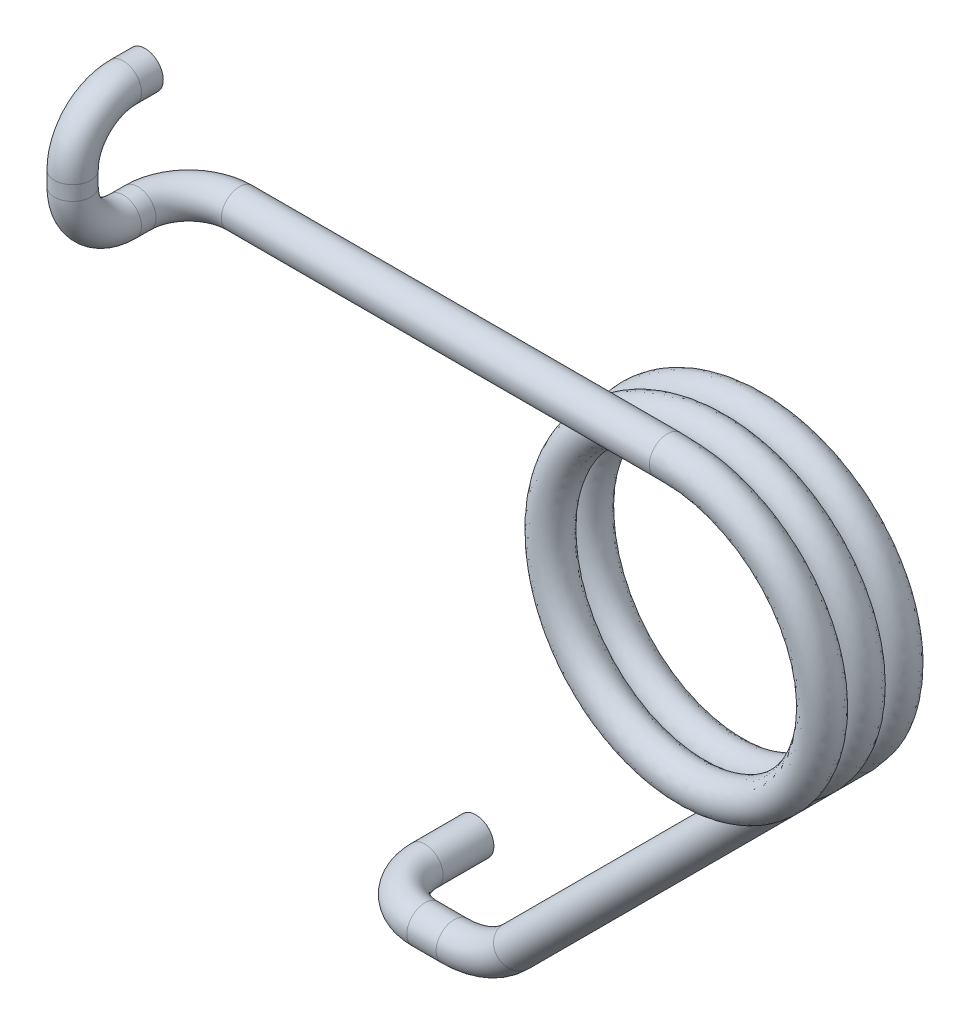
from build123d import *
from build123d.topology import SkipClean

# Parameters (mm, degrees)
BASE_BALAYAGE_PITCH       = 2.6
BASE_BALAYAGE_HEIGHT      = 6.175
BASE_BALAYAGE_RADIUS      = 10
BASE_BALAYAGE_START_ANGLE = 90
ESQUISSE2_R               = 1.25
ESQUISSE3_R               = 1.25
ESQUISSE4_R               = 1.25


with BuildPart() as part:
    # Base-Balayage: sweep along a helix
    with BuildLine() as base_balayage_path:
        add(Helix(BASE_BALAYAGE_PITCH, BASE_BALAYAGE_HEIGHT, BASE_BALAYAGE_RADIUS, center=(0, 0, 0), direction=(0, 0, -1), mode=Mode.PRIVATE).rotate(Axis((0, 0, 0), (0, 0, -1)), BASE_BALAYAGE_START_ANGLE))
    # Esquisse2 → Base-Balayage (sweep)
    with BuildSketch(Plane(origin=(0, 0, 0), x_dir=(0, 0, -1), z_dir=(1, 0, 0))):
        with Locations((0, 10)):
            Circle(ESQUISSE2_R)
    sweep(path=base_balayage_path.line, is_frenet=True)

    # Boss.-Balayage1: sweep along a curve in space
    with BuildLine() as boss_balayage1_path:
        Line((0, 10, 0), (-29.5, 10, 0))
        ThreePointArc((-33, 10, 3.5), (-31.974873734, 10, 1.025126266), (-29.5, 10, 0))
        Line((-33, 10, 3.5), (-33, 10, 4.5))
        ThreePointArc((-33, 13.5, 8), (-33, 11.025126266, 6.974873734), (-33, 10, 4.5))
        Line((-33, 13.5, 8), (-33, 14.5, 8))
        ThreePointArc((-33, 18, 4.5), (-33, 16.974873734, 6.974873734), (-33, 14.5, 8))
        Line((-33, 18, 4.5), (-33, 18, 3))
    # Esquisse3 → Boss.-Balayage1 (sweep)
    with BuildSketch(Plane.ZY):
        with Locations((0, 10)):
            Circle(ESQUISSE3_R)
    sweep(path=boss_balayage1_path.line)

    # Boss.-Balayage2: sweep along a curve in space
    with SkipClean():  # the faces are left unmerged after this step: merging them gives an invalid solid
        with BuildLine() as boss_balayage2_path:
            Line((7.071067812, -7.071067812, -6.175), (-16.627322047, -30.76964757, -6.175))
            ThreePointArc((-20.869955693, -32.527023881, -6.175000002), (-18.573856929, -32.070291877, -6.175000001), (-16.627322047, -30.76964757, -6.175))
            Line((-20.869955693, -32.527023881, -6.175000002), (-22.884674324, -32.527031953, -6.175000004))
            ThreePointArc((-26.384674321, -32.527045975, -9.675000004), (-25.359548056, -32.527041869, -7.200126271), (-22.884674324, -32.527031953, -6.175000004))
            Line((-26.384674321, -32.527045975, -9.675000004), (-26.384674321, -32.527045974, -13.175000007))
        # Esquisse4 → Boss.-Balayage2 (sweep)
        with BuildSketch(Plane(origin=(-2.8331e-05, -2.8331e-05, 0), x_dir=(0.7071096142315938, -0.7071039481301505, -1.9395935214637244e-10), z_dir=(-0.7071039481301505, -0.7071096142315938, -1.939609063639214e-10))):
            with Locations((10.000000001, -6.174999998)):
                Circle(ESQUISSE4_R)
        sweep(path=boss_balayage2_path.line)


solid = part.part
